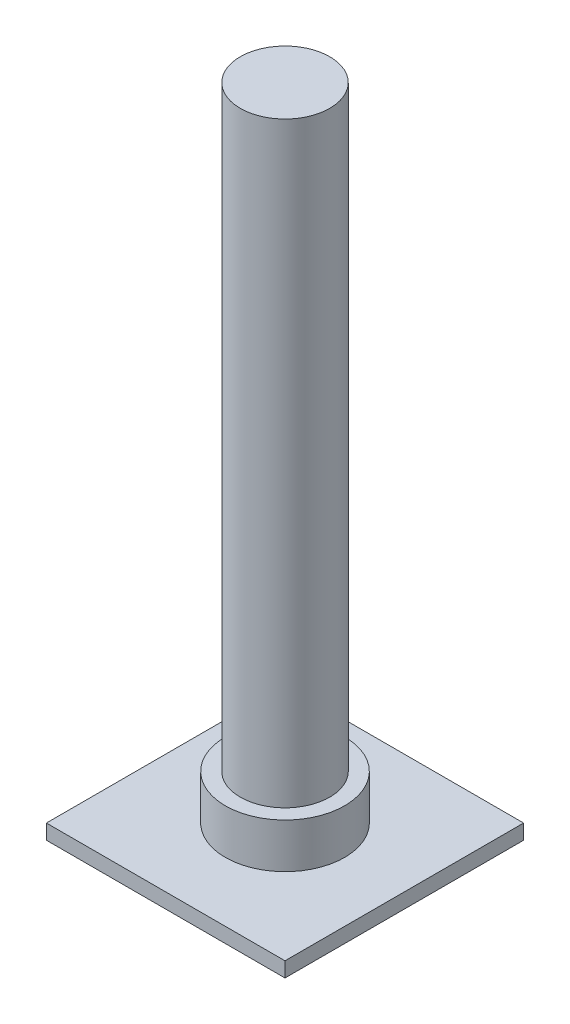
from build123d import *

# Parameters (mm, degrees)
SKETCH_1_W      = 80
SKETCH_1_H      = 80
EXTRUDE_1_DEPTH = 5
SKETCH_2_R      = 20
EXTRUDE_2_DEPTH = 15
SKETCH_3_R      = 15
EXTRUDE_3_DEPTH = 200


with BuildPart() as part:
    # 草图1 → 凸台-拉伸1 (new body)
    with BuildSketch(Plane(origin=(0, 0, 0), x_dir=(1, 0, 0), z_dir=(0, 1, 0))):
        with Locations((40, 40)):
            Rectangle(SKETCH_1_W, SKETCH_1_H)
    extrude(amount=EXTRUDE_1_DEPTH)

    # 草图2 → 凸台-拉伸2 (add)
    with BuildSketch(Plane(origin=(0, 5, 0), x_dir=(1, 0, 0), z_dir=(0, 1, 0))):
        with Locations(Location((40, 40, 0), (0, 0, 270))):
            Circle(SKETCH_2_R)
    extrude(amount=EXTRUDE_2_DEPTH)

    # 草图3 → 凸台-拉伸3 (add)
    with BuildSketch(Plane(origin=(0, 20, 0), x_dir=(1, 0, 0), z_dir=(0, 1, 0))):
        with Locations(Location((40, 40, 0), (0, 0, 270))):
            Circle(SKETCH_3_R)
    extrude(amount=EXTRUDE_3_DEPTH)


solid = part.part
